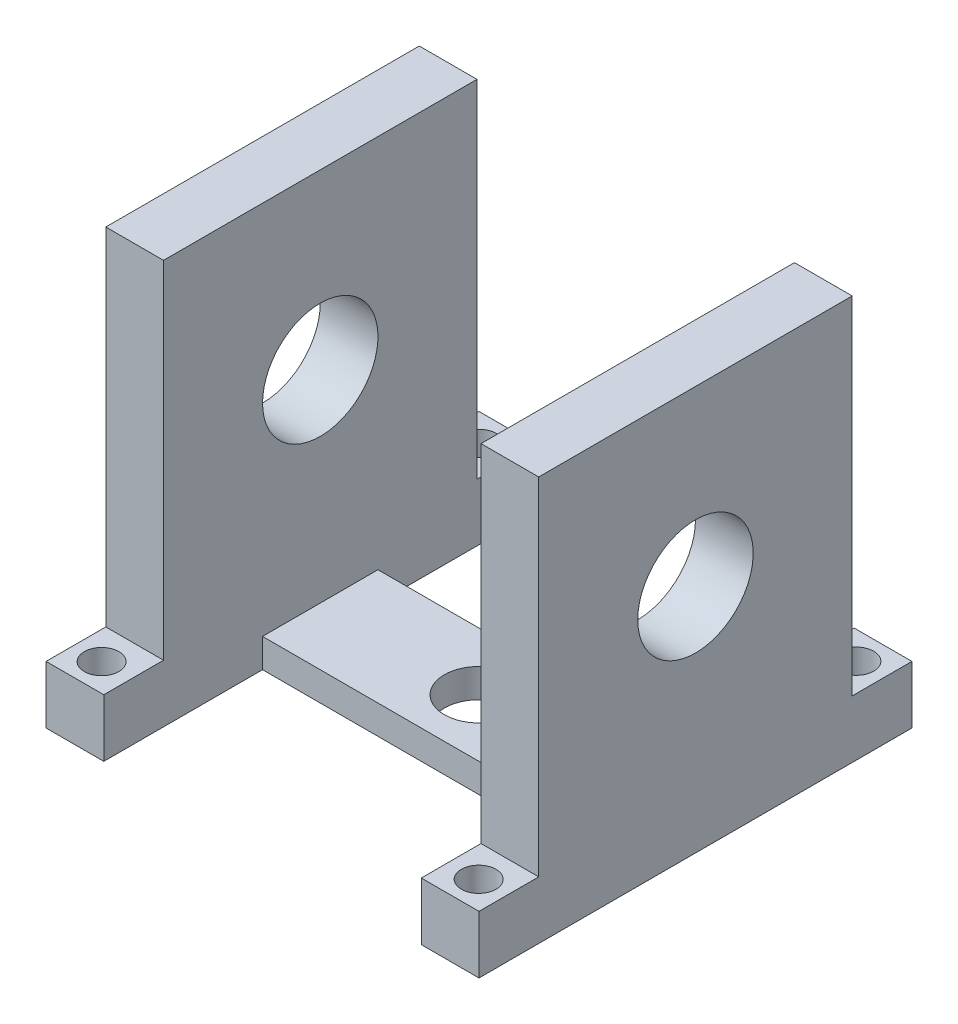
from build123d import *

# Parameters (mm, degrees)
SKETCH1_W               = 75
SKETCH1_H               = 75
SKETCH1_R               = 3
SKETCH1_R_2             = 6
BOSS_EXTRUDE1_DEPTH     = 10
SKETCH2_W               = 10
SKETCH2_H               = 54.30825561
BOSS_EXTRUDE2_DEPTH     = 60
CUT_EXTRUDE1_DEPTH      = 110.230261375
CUT_EXTRUDE1_DEPTH_BACK = 110.230261375
SKETCH3_R               = 10
CUT_EXTRUDE2_DEPTH      = 81.07808689
CUT_EXTRUDE2_DEPTH_BACK = 81.07808689
SKETCH5_W               = 55
SKETCH5_H               = 20
CUT_EXTRUDE3_DEPTH      = 5


with BuildPart() as part:
    # Sketch1 → Boss-Extrude1 (new body)
    with BuildSketch(Plane(origin=(0, 0, 0), x_dir=(1, 0, 0), z_dir=(0, 1, 0))):
        Rectangle(SKETCH1_W, SKETCH1_H)
        with Locations(Location((-32.66, 32.72, 0), (0, 0, 270))):
            Circle(SKETCH1_R, mode=Mode.SUBTRACT)
        with Locations(Location((32.66, 32.72, 0), (0, 0, 90))):
            Circle(SKETCH1_R, mode=Mode.SUBTRACT)
        with Locations(Location((32.66, -32.72, 0), (0, 0, 270))):
            Circle(SKETCH1_R, mode=Mode.SUBTRACT)
        with Locations(Location((-32.66, -32.72, 0), (0, 0, 90))):
            Circle(SKETCH1_R, mode=Mode.SUBTRACT)
        with Locations(Location((0, 0, 0), (0, 0, 270))):
            Circle(SKETCH1_R_2, mode=Mode.SUBTRACT)
    extrude(amount=BOSS_EXTRUDE1_DEPTH)

    # Sketch2 → Boss-Extrude2 (add)
    with BuildSketch(Plane(origin=(0, 10, 0), x_dir=(1, 0, 0), z_dir=(0, 1, 0))):
        with Locations((-32.5, 0)):
            Rectangle(SKETCH2_W, SKETCH2_H)
        with Locations((32.5, 0)):
            Rectangle(SKETCH2_W, SKETCH2_H)
    extrude(amount=BOSS_EXTRUDE2_DEPTH)

    # Sketch3 → Cut-Extrude1 (cut, two sides: drawn at the far end of the back side and taken through both)
    with BuildSketch(Plane.ZY.offset(37.5).offset(-CUT_EXTRUDE1_DEPTH_BACK)):
        with Locations((0, 40)):
            Circle(SKETCH3_R)
    extrude(amount=CUT_EXTRUDE1_DEPTH + CUT_EXTRUDE1_DEPTH_BACK, mode=Mode.SUBTRACT)

    # Sketch4 → Cut-Extrude2 (cut, two sides: drawn at the far end of the back side and taken through both)
    with BuildSketch(Plane(origin=(0, 10, 0), x_dir=(1, 0, 0), z_dir=(0, 1, 0)).offset(-CUT_EXTRUDE2_DEPTH_BACK)):
        Polygon((-27.5, 10), (27.5, 10), (27.5, 27.154127805), (27.5, 37.5), (-27.5, 37.5), (-27.5, 27.154127805), align=None)
        Polygon((27.5, -27.154127805), (27.5, -10), (-27.5, -10), (-27.5, -27.154127805), (-27.5, -37.5), (27.5, -37.5), align=None)
    extrude(amount=CUT_EXTRUDE2_DEPTH + CUT_EXTRUDE2_DEPTH_BACK, mode=Mode.SUBTRACT)

    # Sketch5 → Cut-Extrude3 (cut)
    with BuildSketch(Plane(origin=(0, 10, 0), x_dir=(1, 0, 0), z_dir=(0, 1, 0))):
        Rectangle(SKETCH5_W, SKETCH5_H)
    extrude(amount=-CUT_EXTRUDE3_DEPTH, mode=Mode.SUBTRACT)


solid = part.part
